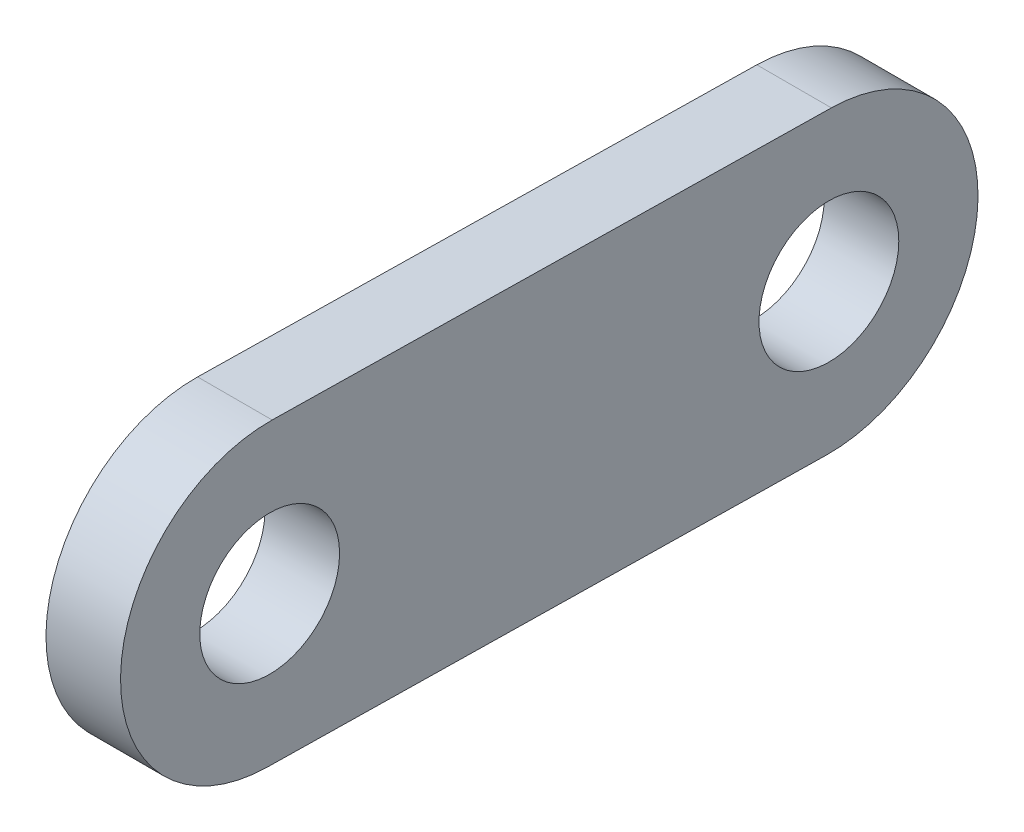
from build123d import *

# Parameters (mm, degrees)
SKETCH1_R           = 46.875
BOSS_EXTRUDE1_DEPTH = 50


with BuildPart() as part:
    # Sketch1 → Boss-Extrude1 (new body)
    with BuildSketch(Plane(origin=(0, 0, 0), x_dir=(0, 0, -1), z_dir=(1, 0, 0))):
        with BuildLine():
            Line((1.666435233, 99.986114004), (376.666435233, 93.736114004))
            ThreePointArc((376.666435233, 93.736114004), (474.986114004, -7.916435233), (373.333564767, -106.236114004))
            Line((373.333564767, -106.236114004), (-1.666435233, -99.986114004))
            ThreePointArc((-1.666435233, -99.986114004), (-99.986114004, 1.666435233), (1.666435233, 99.986114004))
        make_face()
        Circle(SKETCH1_R, mode=Mode.SUBTRACT)
        with Locations((375, -6.25)):
            Circle(SKETCH1_R, mode=Mode.SUBTRACT)
    extrude(amount=BOSS_EXTRUDE1_DEPTH)


solid = part.part
